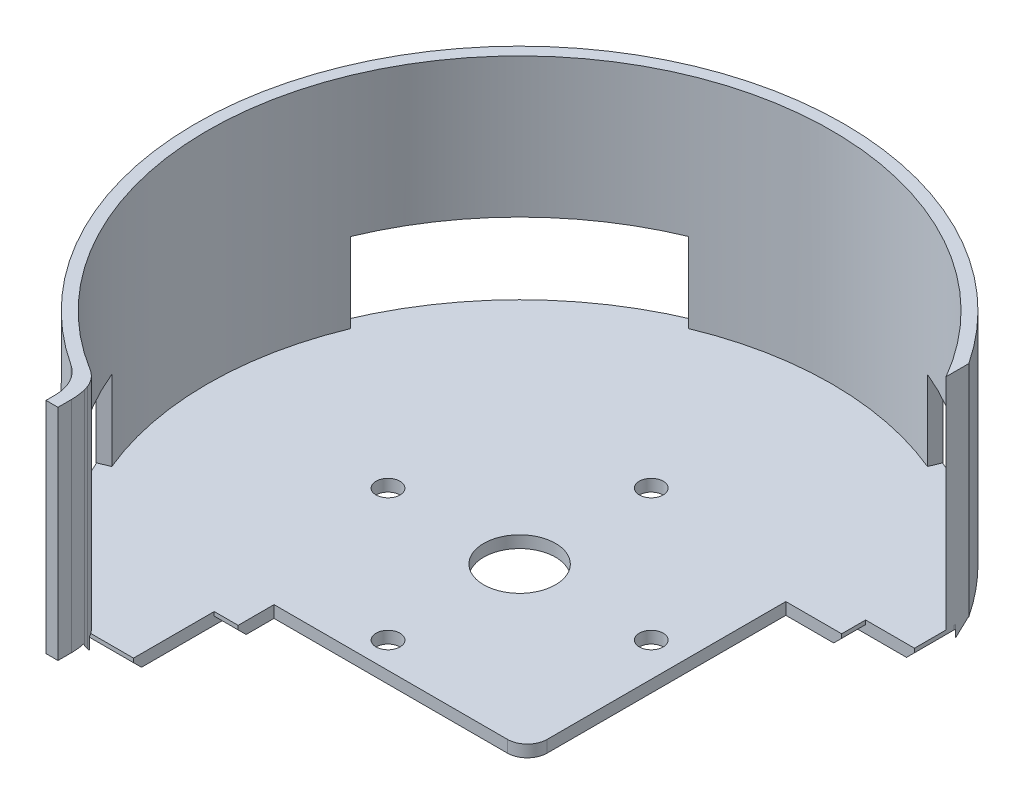
from build123d import *

# Parameters (mm, degrees)
SKETCH1_R           = 9
SKETCH1_R_2         = 3
BOSS_EXTRUDE1_DEPTH = 3
BOSS_EXTRUDE5_DEPTH = 20
CHAMFER1_SIZE       = 2
CHAMFER2_SIZE       = 2
CHAMFER3_SIZE       = 2
CHAMFER4_SIZE       = 2
FILLET3_R           = 2
BOSS_EXTRUDE6_DEPTH = 35
CUT_EXTRUDE1_START  = -35
CUT_EXTRUDE1_DEPTH  = 35


with BuildPart() as part:
    # Sketch1 → Boss-Extrude1 (new body)
    with BuildSketch(Plane(origin=(0, 0, 0), x_dir=(1, 0, 0), z_dir=(0, 1, 0))):
        with BuildLine():
            Line((26.016071882, -39.591378024), (36.516071882, -39.591378024))
            ThreePointArc((36.516071882, -39.591378024), (40.051605788, -38.12691193), (41.516071882, -34.591378024))
            Line((41.516071882, -34.591378024), (41.516071882, -22.764050167))
            Line((41.516071882, -22.764050167), (41.516071882, 25.235949833))
            Line((41.516071882, 25.235949833), (55.516071882, 25.235949833))
            Line((55.516071882, 25.235949833), (55.516071882, 31.235949833))
            Line((55.516071882, 31.235949833), (67.773200773, 31.235949833))
            Line((67.773200773, 31.235949833), (67.773200773, 41.69443681))
            ThreePointArc((67.773200773, 41.69443681), (-56.98852563, 55.53324005), (-39.927712001, -68.828850188))
            Line((-39.927712001, -68.828850188), (-27.983928118, -68.828850188))
            Line((-27.983928118, -68.828850188), (-27.983928118, -48.591378024))
            Line((-27.983928118, -48.591378024), (-21.983928118, -48.591378024))
            Line((-21.983928118, -48.591378024), (-21.983928118, -39.591378024))
            Line((-21.983928118, -39.591378024), (26.016071882, -39.591378024))
        make_face()
        with Locations(Location((0, 0, 0), (0, 0, 270))):
            Circle(SKETCH1_R, mode=Mode.SUBTRACT)
        with Locations(Location((33, 0, 0), (0, 0, 270))):
            Circle(SKETCH1_R_2, mode=Mode.SUBTRACT)
        with Locations(Location((0, -33, 0), (0, 0, 270))):
            Circle(SKETCH1_R_2, mode=Mode.SUBTRACT)
        with Locations(Location((-33, 0, 0), (0, 0, 270))):
            Circle(SKETCH1_R_2, mode=Mode.SUBTRACT)
        with Locations(Location((0, 33, 0), (0, 0, 270))):
            Circle(SKETCH1_R_2, mode=Mode.SUBTRACT)
    extrude(amount=BOSS_EXTRUDE1_DEPTH)

    # Sketch2 → Boss-Extrude5 (add)
    with BuildSketch(Plane(origin=(0, 3, 0), x_dir=(1, 0, 0), z_dir=(0, 1, 0))):
        with BuildLine():
            Line((67.773200773, 39.156481082), (67.773200773, 44.853755219))
            ThreePointArc((67.773200773, 44.853755219), (62.937243445, 51.419543831), (57.467669607, 57.467669607))
            Line((57.467669607, 57.467669607), (55.346349264, 55.346349264))
            ThreePointArc((55.346349264, 55.346349264), (62.089724256, 47.658188126), (67.773200773, 39.156481082))
        make_face()
        with BuildLine():
            Line((-39.927712001, -76.985232291), (-39.927712001, -78.828850188))
            Line((-39.927712001, -78.828850188), (-36.927712001, -78.828850188))
            Line((-36.927712001, -78.828850188), (-36.927712001, -75.424551151))
            ThreePointArc((-36.927712001, -75.424551151), (-37.043512595, -73.56428019), (-37.389126407, -71.732731959))
            ThreePointArc((-37.389126407, -71.732731959), (-37.554188596, -71.15585041), (-37.753552772, -70.589907151))
            ThreePointArc((-37.753552772, -70.589907151), (-39.065927712, -68.356737552), (-41.023031213, -66.659940472))
            ThreePointArc((-41.023031213, -66.659940472), (-48.515602747, -61.422089217), (-55.346349264, -55.346349264))
            Line((-55.346349264, -55.346349264), (-57.467669607, -57.467669607))
            ThreePointArc((-57.467669607, -57.467669607), (-51.250804692, -63.074726465), (-44.490100887, -68.012476968))
            ThreePointArc((-44.490100887, -68.012476968), (-41.472337786, -71.100334086), (-40.037635444, -75.172604325))
            ThreePointArc((-40.037635444, -75.172604325), (-39.955218081, -76.077253312), (-39.927712001, -76.985232291))
        make_face()
        with BuildLine():
            Line((29.953228379, 72.313490189), (31.101278676, 75.085128787))
            ThreePointArc((31.101278676, 75.085128787), (0, 81.271557757), (-31.101278676, 75.085128787))
            Line((-31.101278676, 75.085128787), (-29.953228379, 72.313490189))
            ThreePointArc((-29.953228379, 72.313490189), (0, 78.271557757), (29.953228379, 72.313490189))
        make_face()
        with BuildLine():
            Line((-72.313490189, -29.953228379), (-75.085128787, -31.101278676))
            ThreePointArc((-75.085128787, -31.101278676), (-81.271557757, 0), (-75.085128787, 31.101278676))
            Line((-75.085128787, 31.101278676), (-72.313490189, 29.953228379))
            ThreePointArc((-72.313490189, 29.953228379), (-78.271557757, 0), (-72.313490189, -29.953228379))
        make_face()
    extrude(amount=BOSS_EXTRUDE5_DEPTH)

    # Chamfer1
    chamfer1_edges = [part.edges().sort_by_distance(p)[0] for p in [
        (67.773200773, 0, -36.465193321),
    ]]
    chamfer(chamfer1_edges, length=CHAMFER1_SIZE)

    # Chamfer2
    chamfer2_edges = [part.edges().sort_by_distance(p)[0] for p in [
        (55.516071882, 0, -28.235949833),
    ]]
    chamfer(chamfer2_edges, length=CHAMFER2_SIZE)

    # Chamfer3
    chamfer3_edges = [part.edges().sort_by_distance(p)[0] for p in [
        (-33.955820059, 0, 68.828850188),
    ]]
    chamfer(chamfer3_edges, length=CHAMFER3_SIZE)

    # Chamfer4
    chamfer4_edges = [part.edges().sort_by_distance(p)[0] for p in [
        (-24.983928118, 0, 48.591378024),
    ]]
    chamfer(chamfer4_edges, length=CHAMFER4_SIZE)

    # Fillet3
    fillet3_edges = [part.edges().sort_by_distance(p)[0] for p in [
        (67.773200773, 2.5, -41.69443681),
    ]]
    fillet(fillet3_edges, radius=FILLET3_R)

    # Sketch3 → Boss-Extrude6 (add)
    with BuildSketch(Plane(origin=(0, 23, 0), x_dir=(1, 0, 0), z_dir=(0, 1, 0))):
        with BuildLine():
            Line((67.773200773, 39.156481082), (67.773200773, 44.853755219))
            ThreePointArc((67.773200773, 44.853755219), (-57.621369969, 57.313557062), (-44.490100887, -68.012476968))
            ThreePointArc((-44.490100887, -68.012476968), (-41.472337786, -71.100334086), (-40.037635444, -75.172604325))
            ThreePointArc((-40.037635444, -75.172604325), (-39.955218081, -76.077253312), (-39.927712001, -76.985232291))
            Line((-39.927712001, -76.985232291), (-39.927712001, -78.828850188))
            Line((-39.927712001, -78.828850188), (-36.927712001, -78.828850188))
            Line((-36.927712001, -78.828850188), (-36.927712001, -75.424551151))
            ThreePointArc((-36.927712001, -75.424551151), (-37.043512595, -73.56428019), (-37.389126407, -71.732731959))
            ThreePointArc((-37.389126407, -71.732731959), (-37.554188596, -71.15585041), (-37.753552772, -70.589907151))
            ThreePointArc((-37.753552772, -70.589907151), (-39.065927712, -68.356737552), (-41.023031213, -66.659940472))
            ThreePointArc((-41.023031213, -66.659940472), (-54.572627392, 56.109402894), (67.773200773, 39.156481082))
        make_face()
    extrude(amount=BOSS_EXTRUDE6_DEPTH)

    # Sketch4 → Revolve1 (revolve)
    with BuildSketch(Plane(origin=(0, 0, 0), x_dir=(0, 0, -1), z_dir=(1, 0, 0)), mode=Mode.PRIVATE) as revolve1_sk:
        Polygon((79.448939848, 0), (81.178234321, 3), (79.448939848, 3), align=None)
    revolve(revolve1_sk.sketch.rotate(Axis((0, 0, 0), (0, -1, 0)), 207.35414034), axis=Axis((0, 0, 0), (0, -1, 0)))

    # Sketch5 → Cut-Extrude1 (cut)
    with BuildSketch(Plane(origin=(0, 3, 0), x_dir=(1, 0, 0), z_dir=(0, 1, 0)).offset(CUT_EXTRUDE1_START)):
        with BuildLine():
            Line((67.773200773, 44.684437834), (67.773200773, 41.459948143))
            ThreePointArc((67.773200773, 41.459948143), (57.505508315, -54.8201656), (-38.173959697, -69.676989344))
            ThreePointArc((-38.173959697, -69.676989344), (-37.949405437, -70.126839575), (-37.753552772, -70.589907151))
            ThreePointArc((-37.753552772, -70.589907151), (-37.554188596, -71.15585041), (-37.389126407, -71.732731959))
            ThreePointArc((-37.389126407, -71.732731959), (-37.343653711, -71.916668059), (-37.300507998, -72.101163864))
            ThreePointArc((-37.300507998, -72.101163864), (60.347870238, -54.295858822), (67.773200773, 44.684437834))
        make_face()
    extrude(amount=CUT_EXTRUDE1_DEPTH, mode=Mode.SUBTRACT)


solid = part.part
